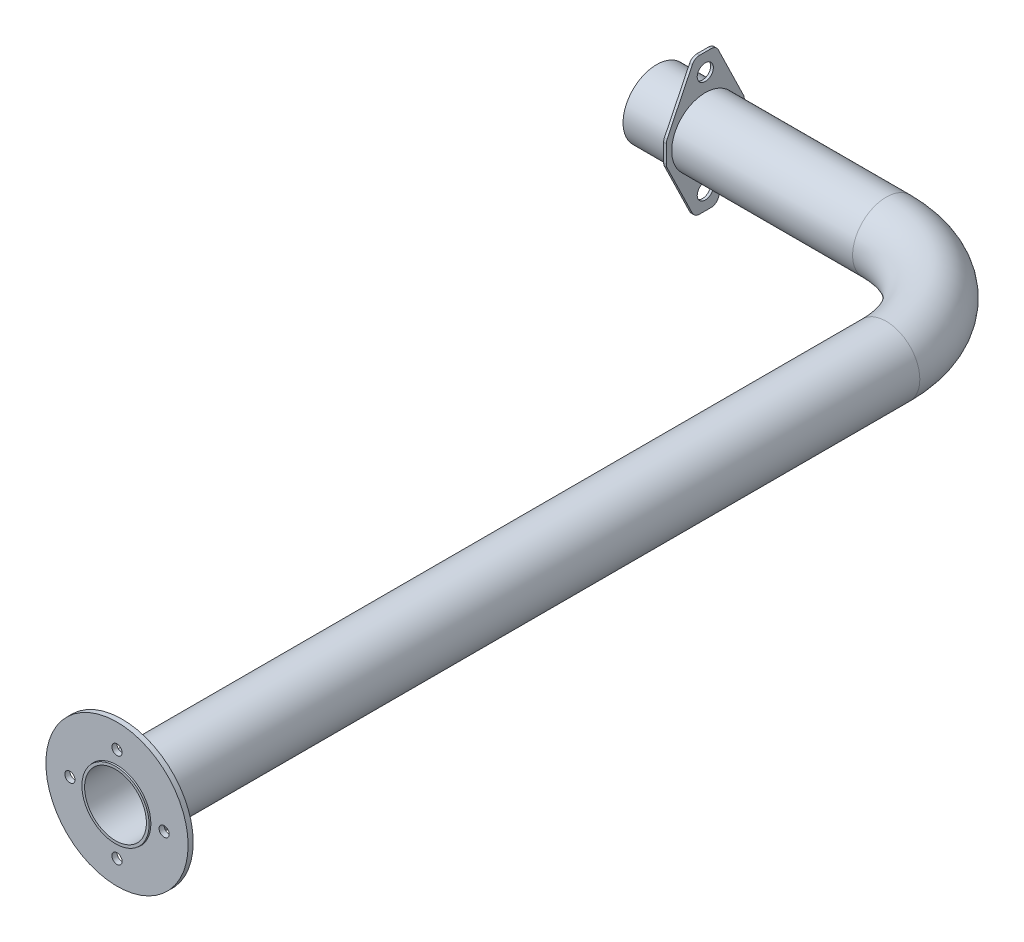
from build123d import *

# Parameters (mm, degrees)
SKETCH1_R           = 42
SKETCH1_R_2         = 20
BOSS_EXTRUDE1_DEPTH = 3
SCALE1_SCALE        = 0.63
SKETCH45_R          = 12.5
SKETCH45_R_2        = 11.5
SKETCH47_R          = 1.89
CUT_EXTRUDE1_DEPTH  = 10
SKETCH50_R          = 3
SKETCH50_R_2        = 11.5
BOSS_EXTRUDE2_DEPTH = 1


with BuildPart() as part:
    # Sketch1 → Boss-Extrude1 (new body)
    with BuildSketch(Plane.XY):
        Circle(SKETCH1_R)
        Circle(SKETCH1_R_2, mode=Mode.SUBTRACT)
    extrude(amount=-BOSS_EXTRUDE1_DEPTH)


with BuildPart() as part_1:
    # Scale1: scaled about (0, 0, -1.5)
    add(part.part.scale(SCALE1_SCALE).moved(Location((0, 0, -0.555))))

    # Sketch47 → Cut-Extrude1 (cut)
    with BuildSketch(Plane(origin=(0, 0, -2.445), x_dir=(-1, 0, 0), z_dir=(0, 0, -1))):
        with Locations((0, 17.53)):
            Circle(SKETCH47_R)
        with Locations((17.53, 0)):
            Circle(SKETCH47_R)
        with Locations((0, -17.53)):
            Circle(SKETCH47_R)
        with Locations((-17.53, 0)):
            Circle(SKETCH47_R)
    extrude(amount=-CUT_EXTRUDE1_DEPTH, mode=Mode.SUBTRACT)


with BuildPart() as body_2:
    # Sweep-Thin1: sweep along a curve in space
    with BuildLine() as sweep_thin1_path:
        Line((0, 0, 0), (0, 0, -286.7))
        ThreePointArc((-40, 0, -326.7), (-11.715728753, 0, -314.984271247), (0, 0, -286.7))
        Line((-40, 0, -326.7), (-125.4, 0, -326.7))
    # Sketch45 → Sweep-Thin1 (sweep)
    with BuildSketch(Plane(origin=(-125.4, 0, 0), x_dir=(0, 0, -1), z_dir=(1, 0, 0))):
        with Locations((326.7, 0)):
            Circle(SKETCH45_R)
        with Locations((326.7, 0)):
            Circle(SKETCH45_R_2, mode=Mode.SUBTRACT)
    sweep(path=sweep_thin1_path.line)


with BuildPart() as body_3:
    # Sketch50 → Boss-Extrude2 (new body)
    with BuildSketch(Plane(origin=(-108.3, 0, 0), x_dir=(0, 0, -1), z_dir=(1, 0, 0))):
        with BuildLine():
            Line((324.577342927, 25.6), (328.822657073, 25.6))
            ThreePointArc((328.822657073, 25.6), (330.41408185, 25.143101882), (331.520760636, 23.911578121))
            Line((331.520760636, 23.911578121), (340.898103562, 4.6210441))
            ThreePointArc((340.898103562, 4.6210441), (341.123551837, 3.982403314), (341.2, 3.30946598))
            Line((341.2, 3.30946598), (341.2, -3.30946598))
            ThreePointArc((341.2, -3.30946598), (341.123551837, -3.982403314), (340.898103562, -4.6210441))
            Line((340.898103562, -4.6210441), (331.520760636, -23.911578121))
            ThreePointArc((331.520760636, -23.911578121), (330.41408185, -25.143101882), (328.822657073, -25.6))
            Line((328.822657073, -25.6), (324.577342927, -25.6))
            ThreePointArc((324.577342927, -25.6), (322.98591815, -25.143101882), (321.879239364, -23.911578121))
            Line((321.879239364, -23.911578121), (312.501896438, -4.6210441))
            ThreePointArc((312.501896438, -4.6210441), (312.276448163, -3.982403314), (312.2, -3.30946598))
            Line((312.2, -3.30946598), (312.2, 3.30946598))
            ThreePointArc((312.2, 3.30946598), (312.276448163, 3.982403314), (312.501896438, 4.6210441))
            Line((312.501896438, 4.6210441), (321.879239364, 23.911578121))
            ThreePointArc((321.879239364, 23.911578121), (322.98591815, 25.143101882), (324.577342927, 25.6))
        make_face()
        with Locations((326.7, 19.1)):
            Circle(SKETCH50_R, mode=Mode.SUBTRACT)
        with Locations((326.7, 0)):
            Circle(SKETCH50_R_2, mode=Mode.SUBTRACT)
        with Locations((326.7, -19.1)):
            Circle(SKETCH50_R, mode=Mode.SUBTRACT)
    extrude(amount=BOSS_EXTRUDE2_DEPTH)


solid = Compound([part_1.part, body_2.part, body_3.part])
